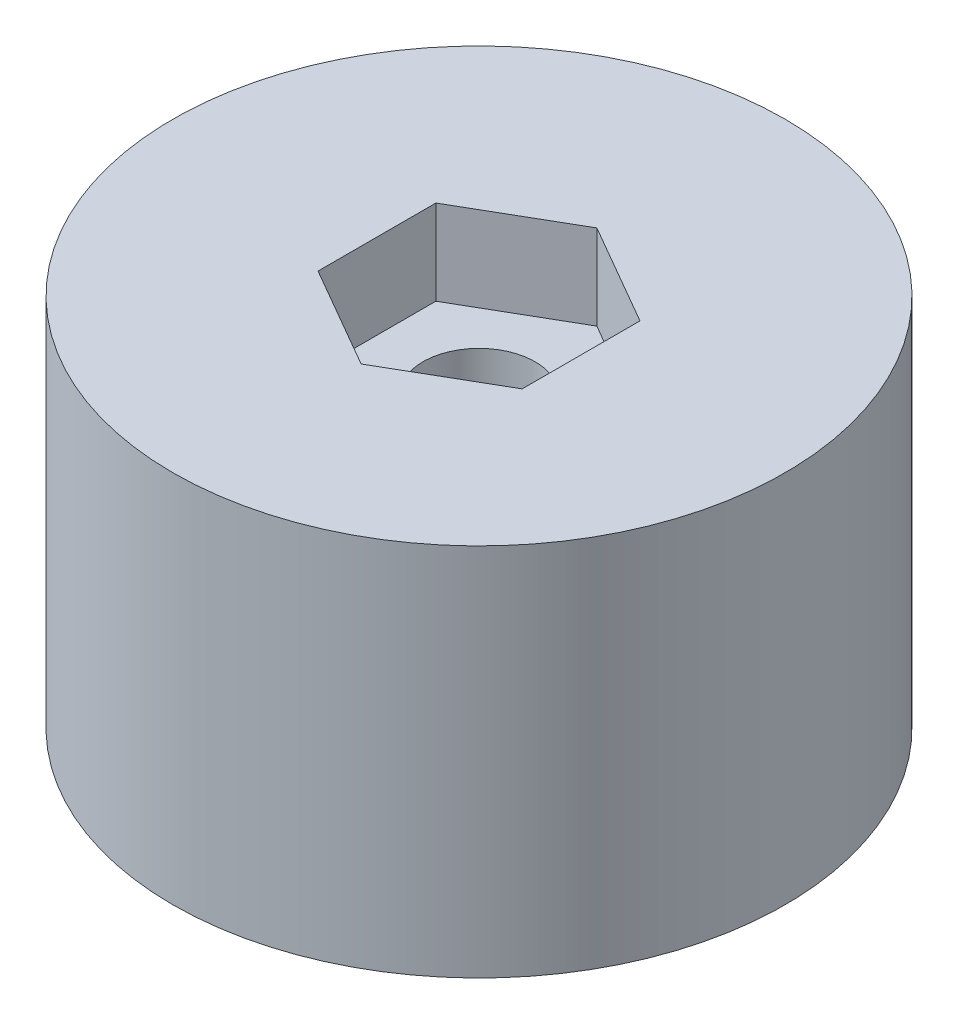
from build123d import *

# Parameters (mm, degrees)
SKETCH1_R           = 9
BOSS_EXTRUDE1_DEPTH = 11
CUT_EXTRUDE1_REACH  = 18.823
SKETCH2_R           = 1.65
CUT_EXTRUDE2_DEPTH  = 2.5


with BuildPart() as part:
    # Sketch1 → Boss-Extrude1 (new body)
    with BuildSketch(Plane(origin=(0, 0, 0), x_dir=(1, 0, 0), z_dir=(0, 1, 0))):
        with Locations(Location((0, 0, 0), (0, 0, 270))):
            Circle(SKETCH1_R)
    extrude(amount=BOSS_EXTRUDE1_DEPTH)

    # Sketch2 → Cut-Extrude1 (cut, up to next)
    with BuildSketch(Plane(origin=(0, 11, 0), x_dir=(1, 0, 0), z_dir=(0, 1, 0)), mode=Mode.PRIVATE) as cut_extrude1_sk1:
        with Locations(Location((0, 0, 0), (0, 0, 270))):
            Circle(SKETCH2_R)
    cut_extrude1_tool1 = extrude(cut_extrude1_sk1.sketch, amount=-CUT_EXTRUDE1_REACH, mode=Mode.PRIVATE) & part.part
    add(cut_extrude1_tool1.solids().sort_by_distance((0, 11, 0))[0], mode=Mode.SUBTRACT)

    # Sketch3 → Cut-Extrude2 (cut)
    with BuildSketch(Plane(origin=(0, 11, 0), x_dir=(1, 0, 0), z_dir=(0, 1, 0))):
        Polygon((3, -1.732050808), (3, 1.732050808), (0, 3.464101615), (-3, 1.732050808), (-3, -1.732050808), (0, -3.464101615), align=None)
    extrude(amount=-CUT_EXTRUDE2_DEPTH, mode=Mode.SUBTRACT)


solid = part.part
